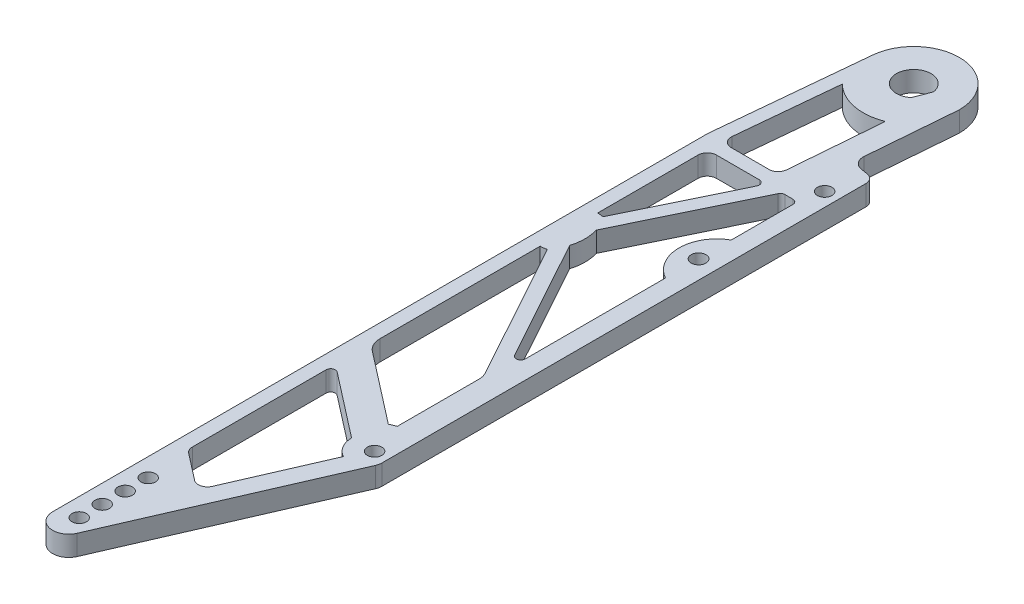
from build123d import *

# Parameters (mm, degrees)
SKETCH2_R           = 2
SKETCH2_R_2         = 1.999999991
BOSS_EXTRUDE1_DEPTH = 5.588
SKETCH7_R           = 2.032
CUT_EXTRUDE1_DEPTH  = 5.588


with BuildPart() as part:
    # Sketch2 → Boss-Extrude1 (new body)
    with BuildSketch(Plane(origin=(0, 0, 0), x_dir=(1, 0, 0), z_dir=(0, 1, 0))):
        with BuildLine():
            ThreePointArc((17.295902343, -30.526810701), (16.688093876, -28.878103365), (15.15555913, -28.018449791))
            Line((15.15555913, -28.018449791), (13.238676936, -27.713033224))
            ThreePointArc((13.238676936, -27.713033224), (11.241051513, -26.538356195), (10.573787778, -24.319092227))
            Line((10.573787778, -24.319092227), (12.5603, 0))
            ThreePointArc((12.5603, 0), (0.603657177, 12.545785512), (-12.502275592, 1.2059192))
            Line((-12.502275592, 1.2059192), (-16.498266045, -40.222207921))
            ThreePointArc((-16.498266045, -40.222207921), (-16.507064815, -40.344000039), (-16.51, -40.466074291))
            Line((-16.51, -40.466074291), (-16.51, -221.328861788))
            ThreePointArc((-16.51, -221.328861788), (-12.970187584, -225.680718913), (-7.988667969, -223.101301399))
            Line((-7.988667969, -223.101301399), (16.979901226, -165.677523619))
            ThreePointArc((16.979901226, -165.677523619), (17.216065593, -164.934164738), (17.295902343, -164.158289667))
            Line((17.295902343, -164.158289667), (17.295902343, -30.526810701))
        make_face()
        with Locations(Location((-11.43, -219.075, 0), (0, 0, 270))):
            Circle(SKETCH2_R, mode=Mode.SUBTRACT)
        with Locations(Location((-11.43, -212.725, 0), (0, 0, 270))):
            Circle(SKETCH2_R, mode=Mode.SUBTRACT)
        with Locations(Location((-11.43, -206.375, 0), (0, 0, 270))):
            Circle(SKETCH2_R, mode=Mode.SUBTRACT)
        with Locations(Location((-11.43, -200.025, 0), (0, 0, 270))):
            Circle(SKETCH2_R, mode=Mode.SUBTRACT)
        with BuildLine():
            ThreePointArc((7.135902343, -162.410770806), (8.023611961, -165.648962244), (10.438542905, -167.981776143))
            Line((10.438542905, -167.981776143), (-0.534170778, -193.217289931))
            ThreePointArc((-0.534170778, -193.217289931), (-2.234040931, -194.665234867), (-4.420389569, -194.211381682))
            Line((-4.420389569, -194.211381682), (-11.716886202, -188.551043102))
            ThreePointArc((-11.716886202, -188.551043102), (-12.441018517, -187.661516081), (-12.7, -186.544128716))
            Line((-12.7, -186.544128716), (-12.7, -149.615408258))
            ThreePointArc((-12.7, -149.615408258), (-11.988693683, -148.474898999), (-10.651556899, -148.611951065))
            Line((-10.651556899, -148.611951065), (7.135902343, -162.410770806))
        make_face(mode=Mode.SUBTRACT)
        with BuildLine():
            ThreePointArc((10.656105825, -153.315833936), (9.771695946, -153.639779081), (8.923603828, -154.049487576))
            Line((8.923603828, -154.049487576), (-10.733772403, -138.80005889))
            ThreePointArc((-10.733772403, -138.80005889), (-12.182037035, -137.021004847), (-12.7, -134.786230117))
            Line((-12.7, -134.786230117), (-12.7, -90.4875))
            ThreePointArc((-12.7, -90.4875), (-11.803536501, -90.43671411), (-10.918544548, -90.285006317))
            Line((-10.918544548, -90.285006317), (10.027134635, -128.362607876))
            ThreePointArc((10.027134635, -128.362607876), (10.49635106, -129.547067395), (10.656105825, -130.811024207))
            Line((10.656105825, -130.811024207), (10.656105825, -153.315833936))
        make_face(mode=Mode.SUBTRACT)
        with Locations(Location((13.485902343, -162.410770806, 0), (0, 0, 270))):
            Circle(SKETCH2_R, mode=Mode.SUBTRACT)
        with BuildLine():
            Line((-10.16, -44.337182032), (1.663048834, -44.337182032))
            ThreePointArc((1.663048834, -44.337182032), (2.739129831, -44.932682449), (2.806066447, -46.160725831))
            Line((2.806066447, -46.160725831), (-11.055993219, -74.784618621))
            ThreePointArc((-11.055993219, -74.784618621), (-11.873503915, -74.655646925), (-12.7, -74.6125))
            Line((-12.7, -74.6125), (-12.7, -46.877182032))
            ThreePointArc((-12.7, -46.877182032), (-11.956051224, -45.081130808), (-10.16, -44.337182032))
        make_face(mode=Mode.SUBTRACT)
        with BuildLine():
            ThreePointArc((-9.903213406, -40.527182032), (-11.783508673, -39.694838236), (-12.431479451, -37.743315662))
            Line((-12.431479451, -37.743315662), (-9.755434212, -9.99962016))
            ThreePointArc((-9.755434212, -9.99962016), (-2.756273581, -13.695395429), (5.127655889, -12.99492382))
            Line((5.127655889, -12.99492382), (3.069264048, -38.19397392))
            ThreePointArc((3.069264048, -38.19397392), (2.259083254, -39.854914801), (0.537695935, -40.527182032))
            Line((0.537695935, -40.527182032), (-9.903213406, -40.527182032))
        make_face(mode=Mode.SUBTRACT)
        with BuildLine():
            ThreePointArc((2.999946232, -3.71521973), (-4.455639512, 1.717501551), (4.717447783, 0.740419782))
            Line((4.717447783, 0.740419782), (2.999946232, -3.71521973))
        make_face(mode=Mode.SUBTRACT)
        with BuildLine():
            ThreePointArc((-8.804706991, -86.222769023), (-8.262040897, -82.55), (-8.804706991, -78.877230977))
            Line((-8.804706991, -78.877230977), (7.575478058, -45.053638233))
            ThreePointArc((7.575478058, -45.053638233), (8.043996088, -44.531101035), (8.718495671, -44.337182032))
            Line((8.718495671, -44.337182032), (10.945902343, -44.337182032))
            ThreePointArc((10.945902343, -44.337182032), (11.843927955, -44.70915642), (12.215902343, -45.607182032))
            Line((12.215902343, -45.607182032), (12.215902343, -62.618124667))
            ThreePointArc((12.215902343, -62.618124667), (6.881902343, -71.709053992), (12.215902343, -80.799983318))
            Line((12.215902343, -80.799983318), (12.215902343, -119.492817968))
            ThreePointArc((12.215902343, -119.492817968), (11.261891546, -120.722879277), (9.83314514, -120.104922051))
            Line((9.83314514, -120.104922051), (-8.804706991, -86.222769023))
        make_face(mode=Mode.SUBTRACT)
        with Locations(Location((13.485902343, -38.1, 0), (0, 0, 270))):
            Circle(SKETCH2_R_2, mode=Mode.SUBTRACT)
    extrude(amount=BOSS_EXTRUDE1_DEPTH)

    # Sketch7 → Cut-Extrude1 (cut)
    with BuildSketch(Plane(origin=(0, 5.588, 0), x_dir=(1, 0, 0), z_dir=(0, 1, 0))):
        with Locations(Location((12.215902343, -71.655983318, 0), (0, 0, 270))):
            Circle(SKETCH7_R)
    extrude(amount=-CUT_EXTRUDE1_DEPTH, mode=Mode.SUBTRACT)


solid = part.part
